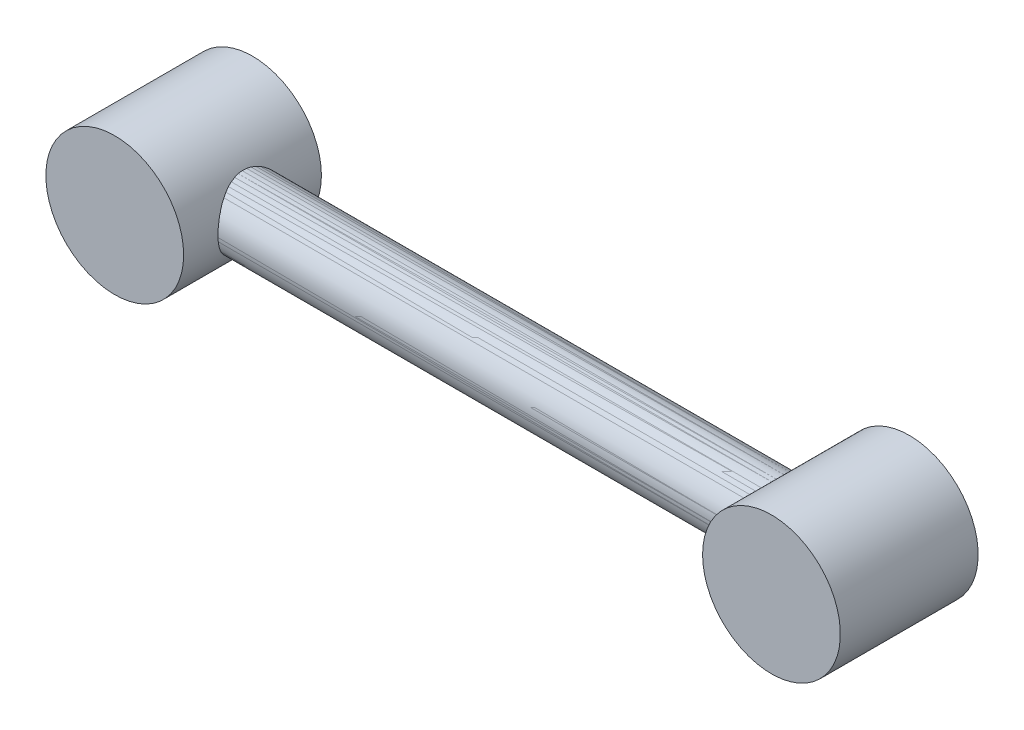
from build123d import *

# Parameters (mm, degrees)
SKETCH1_R                = 5
BOSS_EXTRUDE1_DEPTH      = 80
BOSS_EXTRUDE2_DEPTH      = 10
BOSS_EXTRUDE2_DEPTH_BACK = 10
SKETCH2_R                = 10


with BuildPart() as part:
    # Sketch1 → Boss-Extrude1 (new body)
    with BuildSketch(Plane(origin=(0, 0, 0), x_dir=(0, 0, -1), z_dir=(1, 0, 0))):
        Circle(SKETCH1_R)
    extrude(amount=BOSS_EXTRUDE1_DEPTH)


with BuildPart() as body_2:
    # Sketch2 → Boss-Extrude2 (new, two sides: drawn at the far end of the back side and taken through both)
    with BuildSketch(Plane.XY.offset(-BOSS_EXTRUDE2_DEPTH_BACK)):
        with Locations((-7.666034923, 0)):
            Circle(SKETCH2_R)
    extrude(amount=BOSS_EXTRUDE2_DEPTH + BOSS_EXTRUDE2_DEPTH_BACK)


with BuildPart() as body_3:
    # Mirror1: mirrored copy
    add(part.part.mirror(Plane.ZX.offset(-224)))


with BuildPart() as body_4:
    # Mirror1 2: mirrored copy
    add(body_2.part.mirror(Plane.ZX.offset(-224)))


with BuildPart() as body_5:
    # Mirror2: mirrored copy
    add(part.part.mirror(Plane.ZY.offset(-40)))


with BuildPart() as body_6:
    # Mirror2 2: mirrored copy
    add(body_3.part.mirror(Plane.ZY.offset(-40)))


with BuildPart() as body_7:
    # Mirror2 3: mirrored copy
    add(body_4.part.mirror(Plane.ZY.offset(-40)))


with BuildPart() as body_8:
    # Mirror2 4: mirrored copy
    add(body_2.part.mirror(Plane.ZY.offset(-40)))


solid = Compound([part.part, body_2.part, body_5.part, body_8.part])
